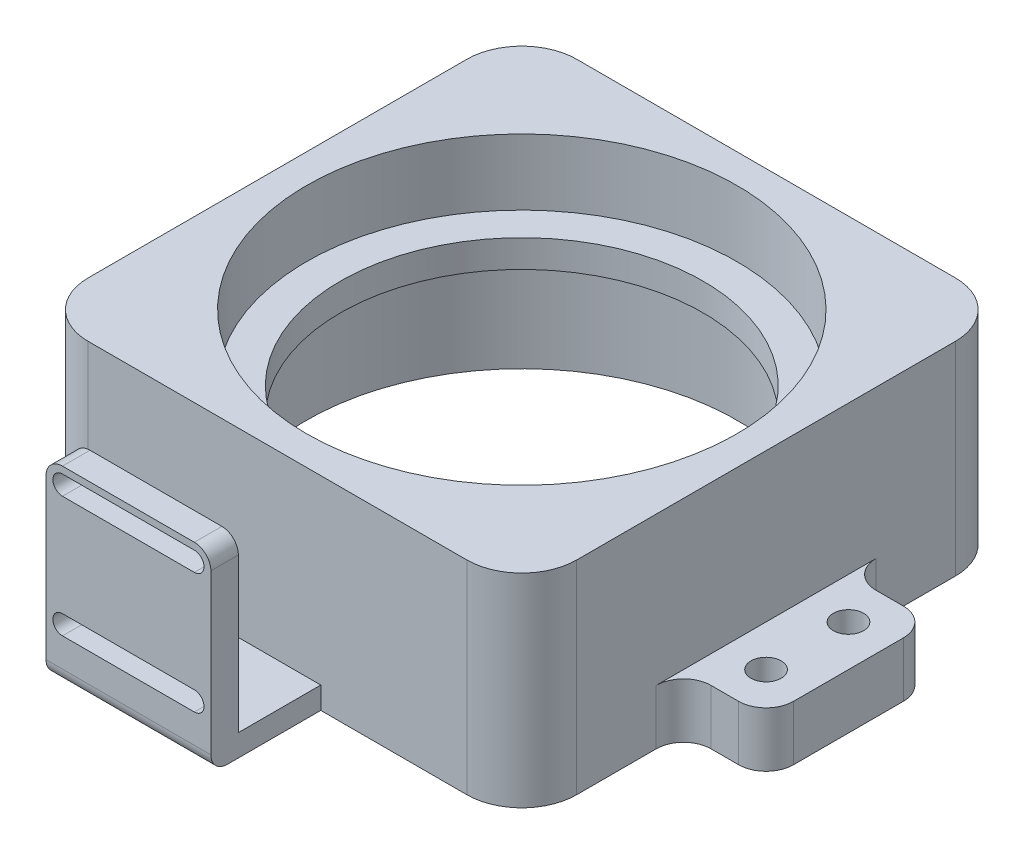
from build123d import *

# Parameters (mm, degrees)
SKETCH1_W           = 88.9
SKETCH1_H           = 88.9
SKETCH1_R           = 39.15
BOSS_EXTRUDE1_DEPTH = 20
SKETCH2_W           = 88.9
SKETCH2_H           = 88.9
SKETCH2_R           = 33
BOSS_EXTRUDE3_DEPTH = 5
SKETCH3_W           = 88.9
SKETCH3_H           = 88.9
SKETCH3_R           = 39.15
BOSS_EXTRUDE4_DEPTH = 12
SKETCH4_W           = 15
SKETCH4_H           = 15
SKETCH4_R           = 2.75
BOSS_EXTRUDE5_DEPTH = 10
FILLET1_R           = 5
FILLET2_R           = 10
SKETCH5_W           = 30
SKETCH5_H           = 4
BOSS_EXTRUDE6_DEPTH = 15
SKETCH6_W           = 30
SKETCH6_H           = 31
SKETCH6_H_2         = 4
BOSS_EXTRUDE7_DEPTH = 5
FILLET3_R           = 3


with BuildPart() as part:
    # Sketch1 → Boss-Extrude1 (new body)
    with BuildSketch(Plane(origin=(0, 0, 0), x_dir=(1, 0, 0), z_dir=(0, 1, 0))):
        with Locations((44.45, 44.45)):
            Rectangle(SKETCH1_W, SKETCH1_H)
        with Locations(Location((44.45, 44.45, 0), (0, 0, 270))):
            Circle(SKETCH1_R, mode=Mode.SUBTRACT)
    extrude(amount=BOSS_EXTRUDE1_DEPTH)

    # Sketch2 → Boss-Extrude3 (add)
    with BuildSketch(Plane(origin=(0, 20, 0), x_dir=(1, 0, 0), z_dir=(0, 1, 0))):
        with Locations((44.45, 44.45)):
            Rectangle(SKETCH2_W, SKETCH2_H)
        with Locations(Location((44.45, 44.45, 0), (0, 0, 270))):
            Circle(SKETCH2_R, mode=Mode.SUBTRACT)
    extrude(amount=BOSS_EXTRUDE3_DEPTH)

    # Sketch3 → Boss-Extrude4 (add)
    with BuildSketch(Plane(origin=(0, 25, 0), x_dir=(1, 0, 0), z_dir=(0, 1, 0))):
        with Locations((44.45, 44.45)):
            Rectangle(SKETCH3_W, SKETCH3_H)
        with Locations(Location((44.45, 44.45, 0), (0, 0, 270))):
            Circle(SKETCH3_R, mode=Mode.SUBTRACT)
    extrude(amount=BOSS_EXTRUDE4_DEPTH)

    # Sketch4 → Boss-Extrude5 (add)
    # profile 1 of 4: a face of its own
    with BuildSketch(Plane.XZ):
        with Locations((-7.5, -36.95)):
            Rectangle(SKETCH4_W, SKETCH4_H)
        with Locations(Location((-7.5, -36.95, 0), (0, 0, 270))):
            Circle(SKETCH4_R, mode=Mode.SUBTRACT)
    # profile 2 of 4: a face of its own
    with BuildSketch(Plane.XZ):
        with Locations((-7.5, -51.95)):
            Rectangle(SKETCH4_W, SKETCH4_H)
        with Locations(Location((-7.5, -51.95, 0), (0, 0, 270))):
            Circle(SKETCH4_R, mode=Mode.SUBTRACT)
    # profile 3 of 4: a face of its own
    with BuildSketch(Plane.XZ):
        with Locations((96.4, -36.95)):
            Rectangle(SKETCH4_W, SKETCH4_H)
        with Locations(Location((96.4, -36.95, 0), (0, 0, 270))):
            Circle(SKETCH4_R, mode=Mode.SUBTRACT)
    # profile 4 of 4: a face of its own
    with BuildSketch(Plane.XZ):
        with Locations((96.4, -51.95)):
            Rectangle(SKETCH4_W, SKETCH4_H)
        with Locations(Location((96.4, -51.95, 0), (0, 0, 270))):
            Circle(SKETCH4_R, mode=Mode.SUBTRACT)
    extrude(amount=-BOSS_EXTRUDE5_DEPTH)

    # Fillet1
    fillet1_edges = [part.edges().sort_by_distance(p)[0] for p in [
        (-15, 5, -59.45),
        (-15, 5, -29.45),
        (0, 5, -29.45),
        (0, 5, -59.45),
        (88.9, 5, -59.45),
        (88.9, 5, -29.45),
        (103.9, 5, -29.45),
        (103.9, 5, -59.45),
    ]]
    fillet(fillet1_edges, radius=FILLET1_R)

    # Fillet2
    fillet2_edges = [part.edges().sort_by_distance(p)[0] for p in [
        (0, 18.5, 0),
        (0, 18.5, -88.9),
        (88.9, 18.5, -88.9),
        (88.9, 18.5, 0),
    ]]
    fillet(fillet2_edges, radius=FILLET2_R)

    # Sketch5 → Boss-Extrude6 (add)
    with BuildSketch(Plane.XY):
        with Locations((37.32503103, 2)):
            Rectangle(SKETCH5_W, SKETCH5_H)
    extrude(amount=BOSS_EXTRUDE6_DEPTH)

    # Sketch6 → Boss-Extrude7 (add)
    # profile 1 of 2: a face of its own
    with BuildSketch(Plane.XY.offset(15)):
        with Locations((37.32503103, 19.5)):
            Rectangle(SKETCH6_W, SKETCH6_H)
        with BuildLine():
            ThreePointArc((25.32503103, 8.25), (23.57503103, 10), (25.32503103, 11.75))
            Line((25.32503103, 11.75), (49.32503103, 11.75))
            ThreePointArc((49.32503103, 11.75), (50.562467897, 11.237436867), (51.07503103, 10))
            ThreePointArc((51.07503103, 10), (50.562467897, 8.762563133), (49.32503103, 8.25))
            Line((49.32503103, 8.25), (25.32503103, 8.25))
        make_face(mode=Mode.SUBTRACT)
        with BuildLine():
            ThreePointArc((25.32503103, 30.25), (23.57503103, 32), (25.32503103, 33.75))
            Line((25.32503103, 33.75), (49.32503103, 33.75))
            ThreePointArc((49.32503103, 33.75), (50.562467897, 33.237436867), (51.07503103, 32))
            ThreePointArc((51.07503103, 32), (50.562467897, 30.762563133), (49.32503103, 30.25))
            Line((49.32503103, 30.25), (25.32503103, 30.25))
        make_face(mode=Mode.SUBTRACT)
    # profile 2 of 2: a face of its own
    with BuildSketch(Plane.XY.offset(15)):
        with Locations((37.32503103, 2)):
            Rectangle(SKETCH6_W, SKETCH6_H_2)
    extrude(amount=BOSS_EXTRUDE7_DEPTH)

    # Fillet3
    fillet3_edges = [part.edges().sort_by_distance(p)[0] for p in [
        (22.32503103, 35, 17.5),
        (52.32503103, 35, 17.5),
        (37.32503103, 0, 20),
    ]]
    fillet(fillet3_edges, radius=FILLET3_R)


solid = part.part
